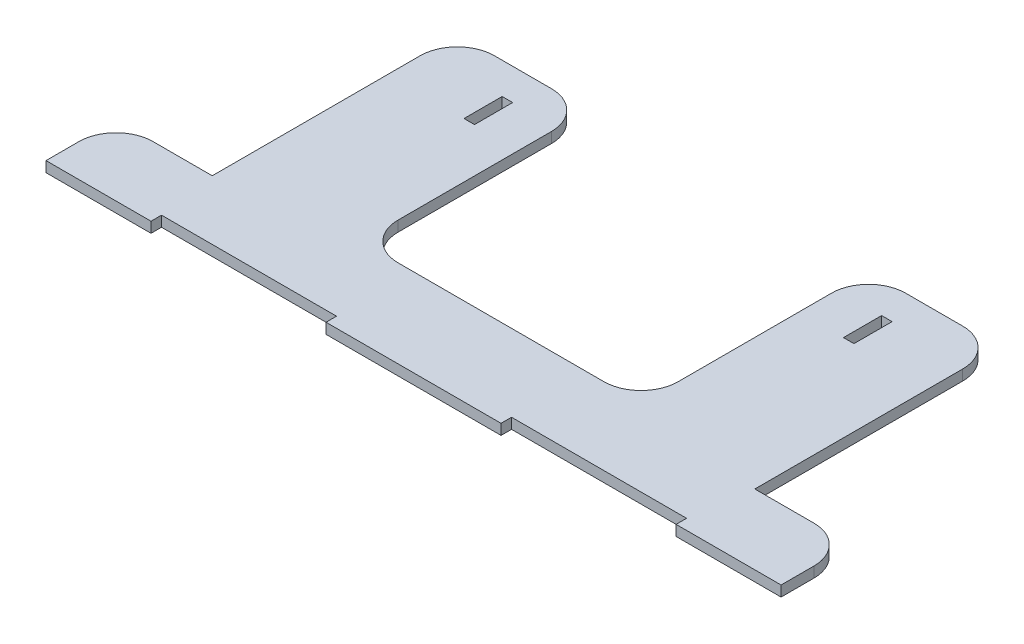
from build123d import *

# Parameters (mm, degrees)
SKETCH1_W                       = 210
SKETCH1_H                       = 120
CHASIS_BASE_DEPTH               = 3
FRONT_AND_BACK_SLOTS_DEPTH      = 279.202975413
FRONT_AND_BACK_SLOTS_DEPTH_BACK = 279.202975413
SKETCH7_W                       = 50
SKETCH7_H                       = 3
BACK_WHEELS_DEPTH               = 279.202975413
BACK_WHEELS_DEPTH_BACK          = 279.202975413
CUT_EXTRUDE1_DEPTH              = 279.202975413
CUT_EXTRUDE1_DEPTH_BACK         = 279.202975413
SKETCH16_W                      = 3
SKETCH16_H                      = 10.9
SKETCH17_W                      = 210
SKETCH17_H                      = 30.004914443
CUT_EXTRUDE2_DEPTH              = 10
SKETCH18_W                      = 80
SKETCH18_H                      = 65
CUT_EXTRUDE3_DEPTH              = 57
CUT_EXTRUDE4_DEPTH              = 10
BOSS_EXTRUDE1_DEPTH             = 3


with BuildPart() as part:
    # Sketch1 → Chasis Base (new body)
    with BuildSketch(Plane(origin=(0, 0, 0), x_dir=(1, 0, 0), z_dir=(0, 1, 0))):
        with Locations((-50.389260457, -170.742439233)):
            Rectangle(SKETCH1_W, SKETCH1_H)
    extrude(amount=CHASIS_BASE_DEPTH)

    # Sketch7 → Front and Back Slots (cut, two sides: drawn at the far end of the back side and taken through both)
    with BuildSketch(Plane(origin=(0, 3, 0), x_dir=(1, 0, 0), z_dir=(0, 1, 0)).offset(-FRONT_AND_BACK_SLOTS_DEPTH_BACK)):
        with Locations((-0.389260457, -229.242439233)):
            Rectangle(SKETCH7_W, SKETCH7_H)
        with Locations((-100.389260457, -229.242439233)):
            Rectangle(SKETCH7_W, SKETCH7_H)
    extrude(amount=FRONT_AND_BACK_SLOTS_DEPTH + FRONT_AND_BACK_SLOTS_DEPTH_BACK, mode=Mode.SUBTRACT)

    # Sketch15 → Back Wheels (cut, two sides: drawn at the far end of the back side and taken through both)
    with BuildSketch(Plane(origin=(0, 3, 0), x_dir=(1, 0, 0), z_dir=(0, 1, 0)).offset(-BACK_WHEELS_DEPTH_BACK)):
        Polygon((-155.389260457, -175.747353676), (-155.389260457, -140.747353676), (-127.889260457, -140.747353676), (-127.889260457, -210.747353676), (-155.389260457, -210.747353676), align=None)
        Polygon((54.610739543, -140.747353676), (27.110739543, -140.747353676), (27.110739543, -210.747353676), (54.610739543, -210.747353676), (54.610739543, -175.747353676), align=None)
    extrude(amount=BACK_WHEELS_DEPTH + BACK_WHEELS_DEPTH_BACK, mode=Mode.SUBTRACT)

    # Sketch16 → Cut-Extrude1 (cut, two sides: drawn at the far end of the back side and taken through both)
    with BuildSketch(Plane(origin=(0, 3, 0), x_dir=(1, 0, 0), z_dir=(0, 1, 0)).offset(-CUT_EXTRUDE1_DEPTH_BACK)):
        with Locations((-104.589260457, -155.177353676)):
            Rectangle(SKETCH16_W, SKETCH16_H)
        with Locations((3.810739543, -155.177353676)):
            Rectangle(SKETCH16_W, SKETCH16_H)
    extrude(amount=CUT_EXTRUDE1_DEPTH + CUT_EXTRUDE1_DEPTH_BACK, mode=Mode.SUBTRACT)

    # Sketch17 → Cut-Extrude2 (cut)
    with BuildSketch(Plane(origin=(0, 3, 0), x_dir=(1, 0, 0), z_dir=(0, 1, 0))):
        with Locations((-50.389260457, -125.744896455)):
            Rectangle(SKETCH17_W, SKETCH17_H)
    extrude(amount=-CUT_EXTRUDE2_DEPTH, mode=Mode.SUBTRACT)

    # Sketch18 → Cut-Extrude3 (cut)
    with BuildSketch(Plane(origin=(0, 0, 0), x_dir=(-1, 0, 0), z_dir=(0, -1, 0))):
        with Locations((50.389260457, -173.247353676)):
            Rectangle(SKETCH18_W, SKETCH18_H)
    extrude(amount=-CUT_EXTRUDE3_DEPTH, mode=Mode.SUBTRACT)

    # Sketch19 → Cut-Extrude4 (cut)
    with BuildSketch(Plane(origin=(0, 3, 0), x_dir=(1, 0, 0), z_dir=(0, 1, 0))):
        with BuildLine():
            Line((-155.389260457, -221.353955394), (-155.389260457, -210.747353676))
            Line((-155.389260457, -210.747353676), (-144.782658739, -210.747353676))
            ThreePointArc((-144.782658739, -210.747353676), (-152.282658739, -213.853955394), (-155.389260457, -221.353955394))
        make_face()
        with BuildLine():
            Line((-127.889260457, -140.747353676), (-117.282658739, -140.747353676))
            ThreePointArc((-117.282658739, -140.747353676), (-124.782658739, -143.853955394), (-127.889260457, -151.353955394))
            Line((-127.889260457, -151.353955394), (-127.889260457, -140.747353676))
        make_face()
        with BuildLine():
            Line((-90.389260457, -151.353955394), (-90.389260457, -140.747353676))
            Line((-90.389260457, -140.747353676), (-100.995862174, -140.747353676))
            ThreePointArc((-100.995862174, -140.747353676), (-93.495862174, -143.853955394), (-90.389260457, -151.353955394))
        make_face()
        with BuildLine():
            Line((-10.389260457, -140.747353676), (0.217341261, -140.747353676))
            ThreePointArc((0.217341261, -140.747353676), (-7.282658739, -143.853955394), (-10.389260457, -151.353955394))
            Line((-10.389260457, -151.353955394), (-10.389260457, -140.747353676))
        make_face()
        with BuildLine():
            Line((27.110739543, -151.353955394), (27.110739543, -140.747353676))
            Line((27.110739543, -140.747353676), (16.504137826, -140.747353676))
            ThreePointArc((16.504137826, -140.747353676), (24.004137826, -143.853955394), (27.110739543, -151.353955394))
        make_face()
        with BuildLine():
            Line((54.610739543, -210.747353676), (44.004137826, -210.747353676))
            ThreePointArc((44.004137826, -210.747353676), (51.504137826, -213.853955394), (54.610739543, -221.353955394))
            Line((54.610739543, -221.353955394), (54.610739543, -210.747353676))
        make_face()
    extrude(amount=-CUT_EXTRUDE4_DEPTH, mode=Mode.SUBTRACT)

    # Sketch20 → Boss-Extrude1 (add)
    with BuildSketch(Plane(origin=(0, 0, 0), x_dir=(1, 0, 0), z_dir=(0, 1, 0))):
        with BuildLine():
            Line((-90.389260457, -195.140751958), (-90.389260457, -205.747353676))
            Line((-90.389260457, -205.747353676), (-79.782658739, -205.747353676))
            ThreePointArc((-79.782658739, -205.747353676), (-87.282658739, -202.640751958), (-90.389260457, -195.140751958))
        make_face()
        with BuildLine():
            Line((-10.389260457, -205.747353676), (-20.995862174, -205.747353676))
            ThreePointArc((-20.995862174, -205.747353676), (-13.495862174, -202.640751958), (-10.389260457, -195.140751958))
            Line((-10.389260457, -195.140751958), (-10.389260457, -205.747353676))
        make_face()
    extrude(amount=BOSS_EXTRUDE1_DEPTH)


solid = part.part
